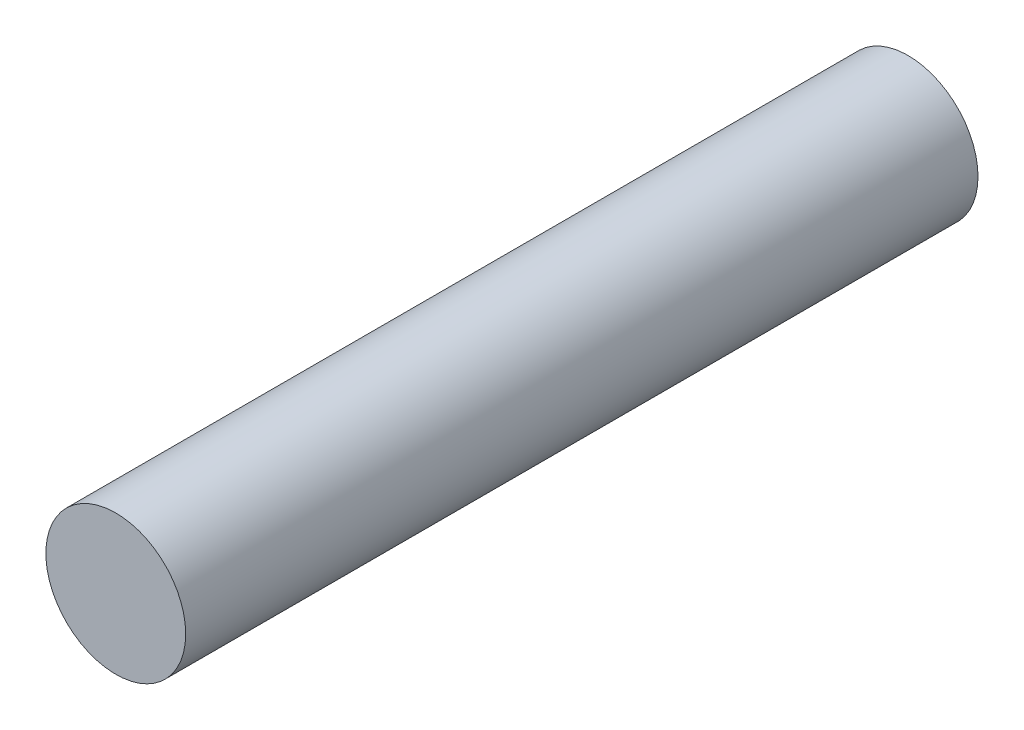
from build123d import *

# Parameters (mm, degrees)
SKETCH1_R           = 3
BOSS_EXTRUDE1_DEPTH = 17


with BuildPart() as part:
    # Sketch1 → Boss-Extrude1 (new, symmetric)
    with BuildSketch(Plane.XY):
        Circle(SKETCH1_R)
    extrude(amount=BOSS_EXTRUDE1_DEPTH, both=True)


solid = part.part
